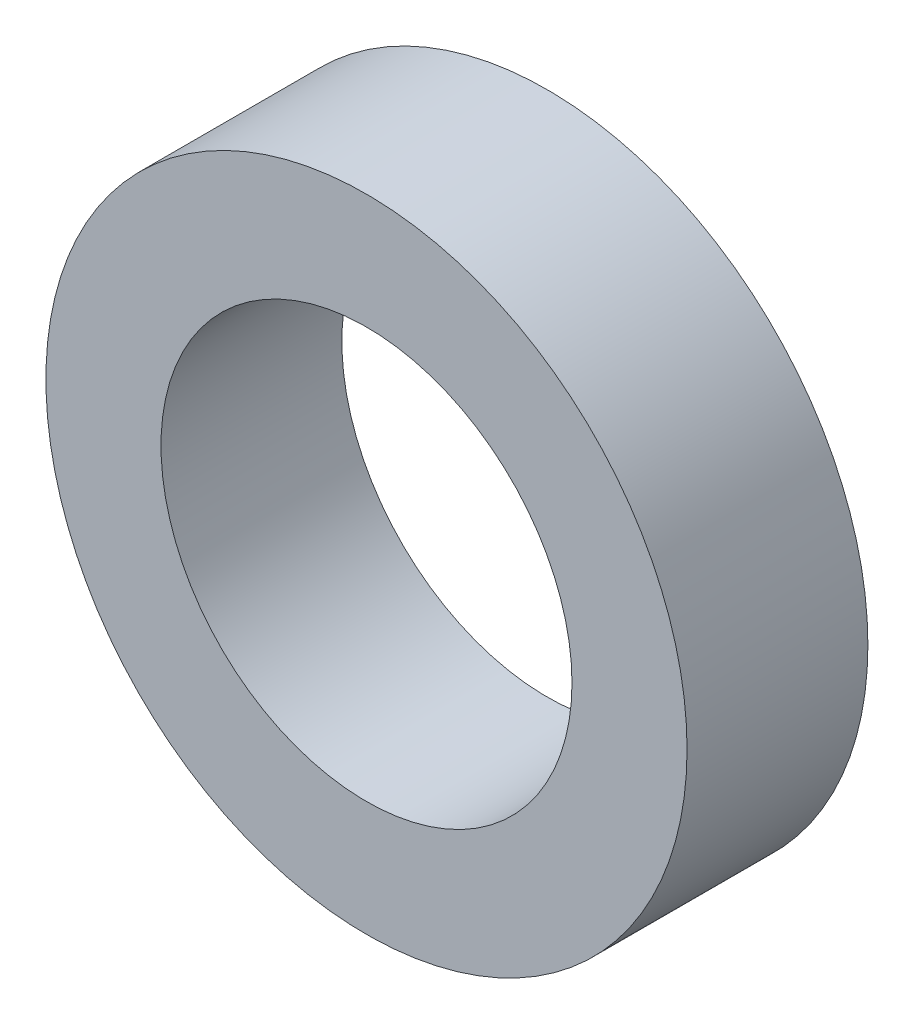
from build123d import *

# Parameters (mm, degrees)
SKETCH_1_R      = 39
SKETCH_1_R_2    = 25
EXTRUDE_1_DEPTH = 22


with BuildPart() as part:
    # 草图1 → 凸台-拉伸1 (new body)
    with BuildSketch(Plane.XY):
        Circle(SKETCH_1_R)
        Circle(SKETCH_1_R_2, mode=Mode.SUBTRACT)
    extrude(amount=EXTRUDE_1_DEPTH)


solid = part.part
